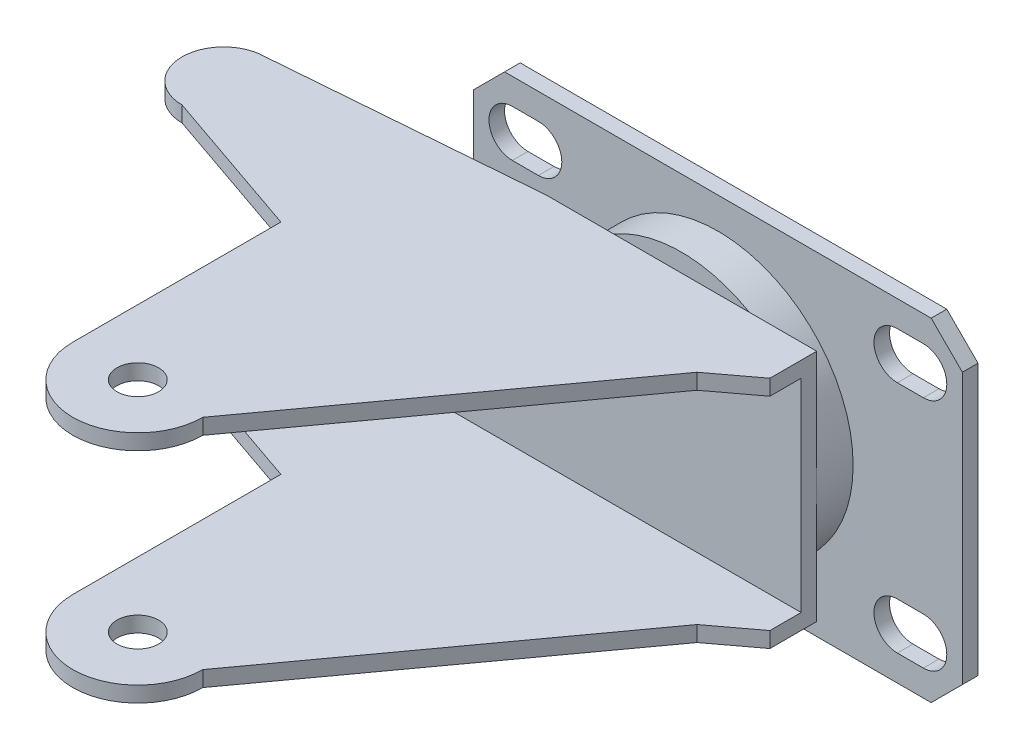
from build123d import *

# Parameters (mm, degrees)
ESQUISSE1_W                  = 94
ESQUISSE1_H                  = 64
BOSS_EXTRU_1_DEPTH           = 3
ESQUISSE2_R                  = 26
BOSS_EXTRU_2_DEPTH           = 7
BOSS_EXTRU_3_DEPTH           = 22.5
BOSS_EXTRU_3_DEPTH_BACK      = 22.5
ENL_V_MAT_EXTRU_1_DEPTH      = 173.665138346
ENL_V_MAT_EXTRU_1_DEPTH_BACK = 173.665138346
ESQUISSE4_W                  = 86
ESQUISSE4_H                  = 39
ENL_V_MAT_EXTRU_2_DEPTH      = 143.697231928
ENL_V_MAT_EXTRU_2_DEPTH_BACK = 143.697231928
ESQUISSE5_R                  = 4
ENL_V_MAT_EXTRU_3_DEPTH      = 3
CHANFREIN1_SIZE              = 6


with BuildPart() as part:
    # Esquisse1 → Boss.-Extru.1 (new body)
    with BuildSketch(Plane.XY):
        with Locations((47, 32)):
            Rectangle(ESQUISSE1_W, ESQUISSE1_H)
    extrude(amount=BOSS_EXTRU_1_DEPTH)

    # Esquisse2 → Boss.-Extru.2 (add)
    with BuildSketch(Plane.XY.offset(3)):
        with Locations((47, 32)):
            Circle(ESQUISSE2_R)
    extrude(amount=BOSS_EXTRU_2_DEPTH)

    # Esquisse3 → Boss.-Extru.3 (add, two sides: drawn at the far end of the back side and taken through both)
    with BuildSketch(Plane(origin=(0, 32, 0), x_dir=(1, 0, 0), z_dir=(0, 1, 0)).offset(-BOSS_EXTRU_3_DEPTH_BACK)):
        with BuildLine():
            Line((73, -10), (73, -19))
            Line((73, -19), (65, -25))
            Line((65, -25), (25, -80))
            ThreePointArc((25, -80), (12.5, -92.5), (0, -80))
            Line((0, -80), (0, -40))
            Line((0, -40), (-29, -30))
            ThreePointArc((-29, -30), (-37, -22), (-29, -14))
            Line((-29, -14), (21, -10))
            Line((21, -10), (73, -10))
        make_face()
    extrude(amount=BOSS_EXTRU_3_DEPTH + BOSS_EXTRU_3_DEPTH_BACK)

    # Esquisse4 → Enlèv. mat.-Extru.1 (cut, two sides: drawn at the far end of the back side and taken through both)
    with BuildSketch(Plane(origin=(94, 0, 0), x_dir=(0, 0, -1), z_dir=(1, 0, 0)).offset(-ENL_V_MAT_EXTRU_1_DEPTH_BACK)):
        with Locations((-56, 32)):
            Rectangle(ESQUISSE4_W, ESQUISSE4_H)
    extrude(amount=ENL_V_MAT_EXTRU_1_DEPTH + ENL_V_MAT_EXTRU_1_DEPTH_BACK, mode=Mode.SUBTRACT)

    # Esquisse5 → Enlèv. mat.-Extru.2 (cut, two sides: drawn at the far end of the back side and taken through both)
    with BuildSketch(Plane.XZ.offset(-9.5).offset(-ENL_V_MAT_EXTRU_2_DEPTH_BACK)):
        with Locations(Location((12.5, 80, 0), (0, 0, 270))):
            Circle(ESQUISSE5_R)
    extrude(amount=ENL_V_MAT_EXTRU_2_DEPTH + ENL_V_MAT_EXTRU_2_DEPTH_BACK, mode=Mode.SUBTRACT)

    # Esquisse6 → Enlèv. mat.-Extru.3 (cut)
    with BuildSketch(Plane(origin=(0, 0, 0), x_dir=(-1, 0, 0), z_dir=(0, 0, -1))):
        with BuildLine():
            Line((-86.5, 59), (-81.5, 59))
            ThreePointArc((-81.5, 59), (-77, 54.5), (-81.5, 50))
            Line((-81.5, 50), (-86.5, 50))
            ThreePointArc((-86.5, 50), (-91, 54.5), (-86.5, 59))
        make_face()
        with BuildLine():
            Line((-7.5, 59), (-12.5, 59))
            ThreePointArc((-12.5, 59), (-17, 54.5), (-12.5, 50))
            Line((-12.5, 50), (-7.5, 50))
            ThreePointArc((-7.5, 50), (-3, 54.5), (-7.5, 59))
        make_face()
        with BuildLine():
            Line((-7.5, 5), (-12.5, 5))
            ThreePointArc((-12.5, 5), (-17, 9.5), (-12.5, 14))
            Line((-12.5, 14), (-7.5, 14))
            ThreePointArc((-7.5, 14), (-3, 9.5), (-7.5, 5))
        make_face()
        with BuildLine():
            Line((-86.5, 5), (-81.5, 5))
            ThreePointArc((-81.5, 5), (-77, 9.5), (-81.5, 14))
            Line((-81.5, 14), (-86.5, 14))
            ThreePointArc((-86.5, 14), (-91, 9.5), (-86.5, 5))
        make_face()
    extrude(amount=-ENL_V_MAT_EXTRU_3_DEPTH, mode=Mode.SUBTRACT)

    # Chanfrein1
    chanfrein1_edges = [part.edges().sort_by_distance(p)[0] for p in [
        (0, 64, 1.5),
        (94, 64, 1.5),
        (94, 0, 1.5),
        (0, 0, 1.5),
    ]]
    chamfer(chanfrein1_edges, length=CHANFREIN1_SIZE)


solid = part.part
